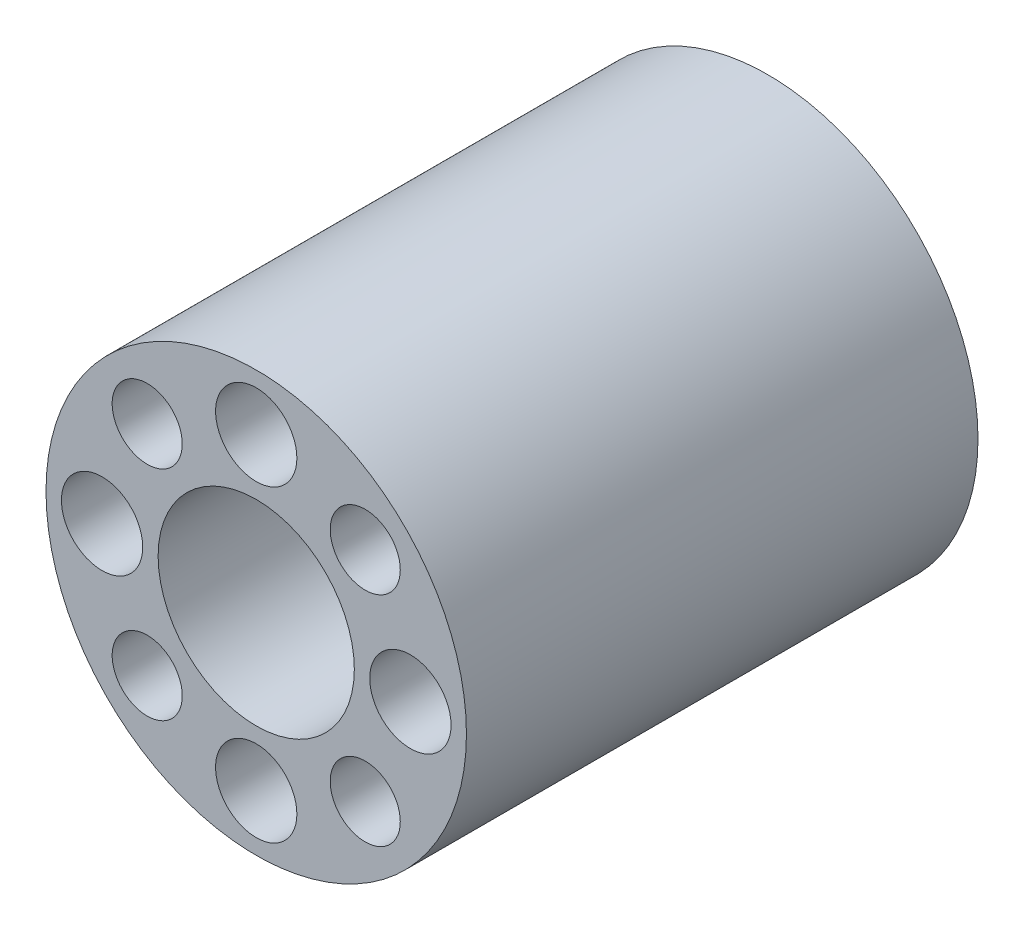
from build123d import *

# Parameters (mm, degrees)
SKIZZE1_R                       = 15
SKIZZE1_R_2                     = 7
SKIZZE1_R_3                     = 1.65
AUFSATZ_LINEAR_AUSTRAGEN1_DEPTH = 36.5
SKIZZE2_R                       = 2.9
SCHNITT_LINEAR_AUSTRAGEN1_DEPTH = 24.5
SKIZZE3_R                       = 2.5
SCHNITT_LINEAR_AUSTRAGEN2_DEPTH = 5


with BuildPart() as part:
    # Skizze1 → Aufsatz-Linear austragen1 (new body)
    with BuildSketch(Plane.XY):
        Circle(SKIZZE1_R)
        Circle(SKIZZE1_R_2, mode=Mode.SUBTRACT)
        with Locations((-11, 0)):
            Circle(SKIZZE1_R_3, mode=Mode.SUBTRACT)
        with Locations((0, 11)):
            Circle(SKIZZE1_R_3, mode=Mode.SUBTRACT)
        with Locations((11, 0)):
            Circle(SKIZZE1_R_3, mode=Mode.SUBTRACT)
        with Locations((0, -11)):
            Circle(SKIZZE1_R_3, mode=Mode.SUBTRACT)
    extrude(amount=AUFSATZ_LINEAR_AUSTRAGEN1_DEPTH)

    # Skizze2 → Schnitt-Linear austragen1 (cut)
    with BuildSketch(Plane.XY.offset(36.5)):
        with Locations((-11, 0)):
            Circle(SKIZZE2_R)
        with Locations((0, 11)):
            Circle(SKIZZE2_R)
        with Locations((11, 0)):
            Circle(SKIZZE2_R)
        with Locations((0, -11)):
            Circle(SKIZZE2_R)
    extrude(amount=-SCHNITT_LINEAR_AUSTRAGEN1_DEPTH, mode=Mode.SUBTRACT)

    # Skizze3 → Schnitt-Linear austragen2 (cut)
    with BuildSketch(Plane.XY.offset(36.5)):
        with Locations((-7.778174593, 7.778174593)):
            Circle(SKIZZE3_R)
        with Locations((7.778174593, 7.778174593)):
            Circle(SKIZZE3_R)
        with Locations((7.778174593, -7.778174593)):
            Circle(SKIZZE3_R)
        with Locations((-7.778174593, -7.778174593)):
            Circle(SKIZZE3_R)
    extrude(amount=-SCHNITT_LINEAR_AUSTRAGEN2_DEPTH, mode=Mode.SUBTRACT)


solid = part.part
